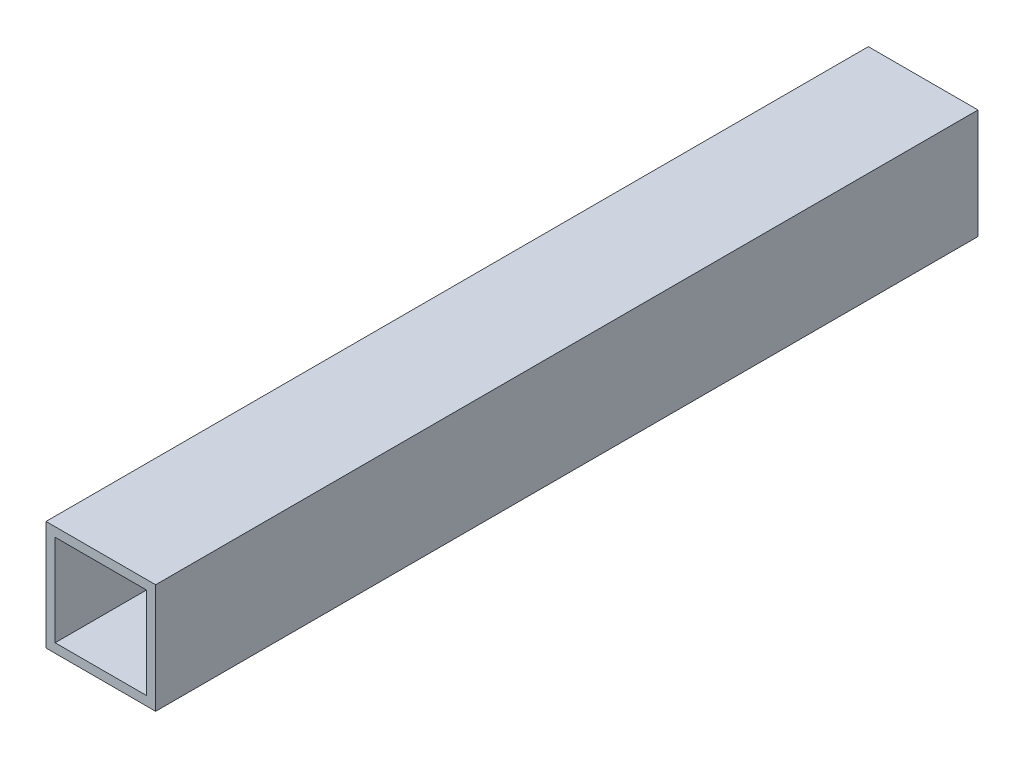
from build123d import *

# Parameters (mm, degrees)
SKETCH_1_W      = 24
SKETCH_1_H      = 24
SKETCH_1_W_2    = 20
SKETCH_1_H_2    = 20
EXTRUDE_1_DEPTH = 180


with BuildPart() as part:
    # 草图1 → 凸台-拉伸1 (new body)
    with BuildSketch(Plane.XY):
        Rectangle(SKETCH_1_W, SKETCH_1_H)
        Rectangle(SKETCH_1_W_2, SKETCH_1_H_2, mode=Mode.SUBTRACT)
    extrude(amount=EXTRUDE_1_DEPTH)


solid = part.part
